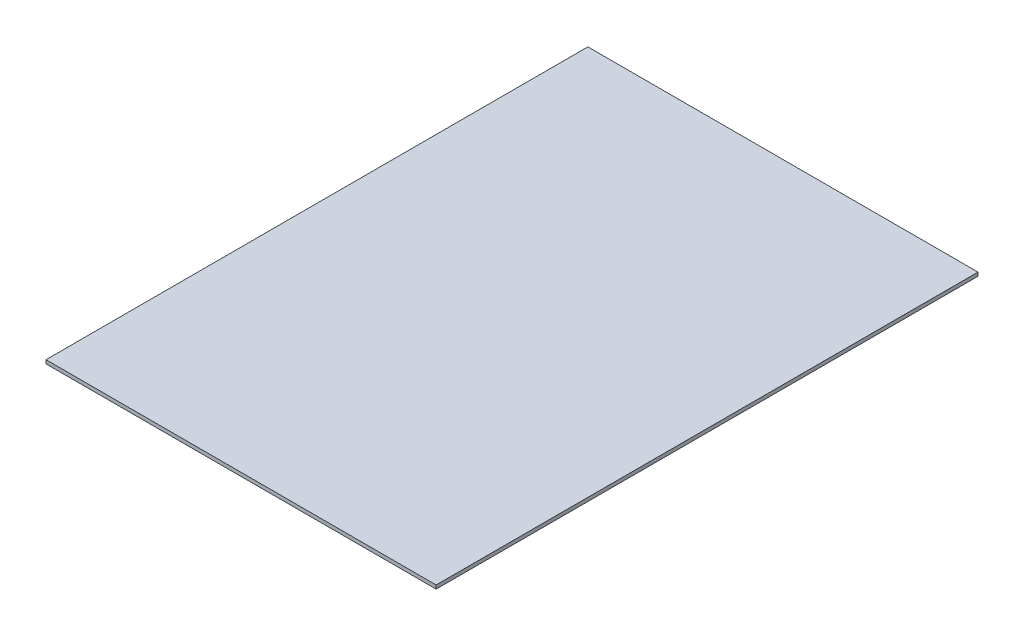
from build123d import *

# Parameters (mm, degrees)
SKETCH1_W           = 540
SKETCH1_H           = 750
BOSS_EXTRUDE1_DEPTH = 5


with BuildPart() as part:
    # Sketch1 → Boss-Extrude1 (new body)
    with BuildSketch(Plane(origin=(0, 0, 0), x_dir=(1, 0, 0), z_dir=(0, 1, 0))):
        with Locations((-270, -375)):
            Rectangle(SKETCH1_W, SKETCH1_H)
    extrude(amount=BOSS_EXTRUDE1_DEPTH)


solid = part.part
